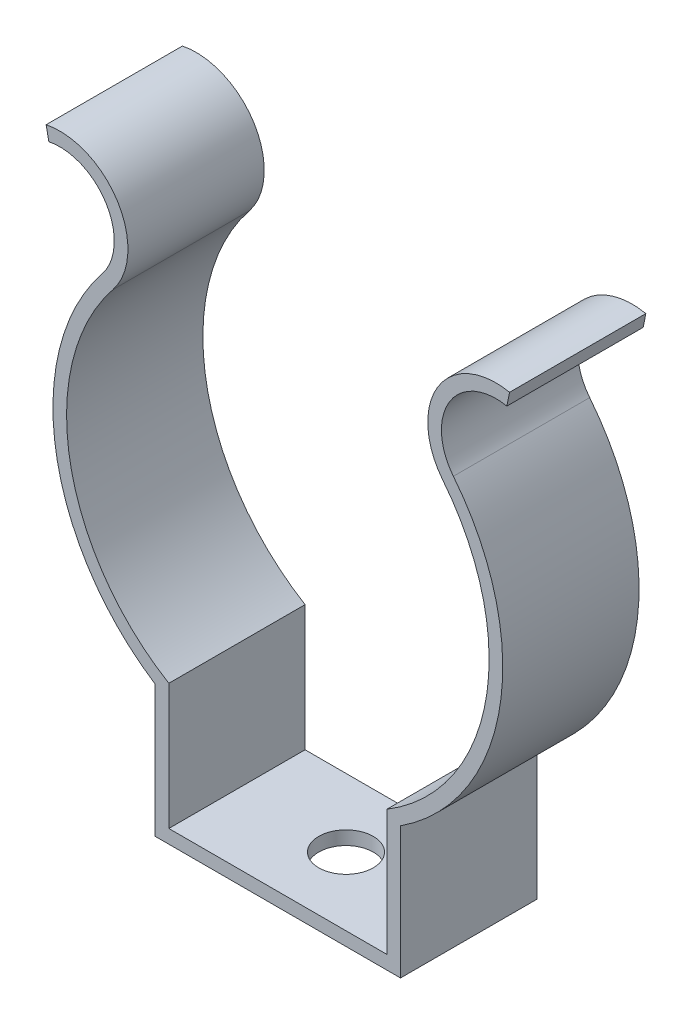
from build123d import *

# Parameters (mm, degrees)
BOSS_EXTRUDE1_DEPTH = 10
SKETCH2_R           = 2
CUT_EXTRUDE1_DEPTH  = 10


with BuildPart() as part:
    # Sketch1 → Boss-Extrude1 (new body)
    with BuildSketch(Plane.XY):
        with BuildLine():
            Line((8, -22.5), (8, -13.275918047))
            ThreePointArc((8, -13.275918047), (15.259032291, -2.722486649), (12.097560976, 9.690150589))
            ThreePointArc((12.097560976, 9.690150589), (11.733206084, 15.422625974), (17, 17.714985104))
            Line((17, 17.714985104), (16.8, 16.735189206))
            ThreePointArc((16.8, 16.735189206), (12.586564868, 14.901301903), (12.87804878, 10.315321595))
            ThreePointArc((12.87804878, 10.315321595), (16.291198361, -2.616649759), (9, -13.829316686))
            Line((9, -13.829316686), (9, -23.5))
            Line((9, -23.5), (-9, -23.5))
            Line((-9, -23.5), (-9, -13.829316686))
            ThreePointArc((-9, -13.829316686), (-16.291198361, -2.616649759), (-12.87804878, 10.315321595))
            ThreePointArc((-12.87804878, 10.315321595), (-12.586564868, 14.901301903), (-16.8, 16.735189206))
            Line((-16.8, 16.735189206), (-17, 17.714985104))
            ThreePointArc((-17, 17.714985104), (-11.733206084, 15.422625974), (-12.097560976, 9.690150589))
            ThreePointArc((-12.097560976, 9.690150589), (-15.259032291, -2.722486649), (-8, -13.275918047))
            Line((-8, -13.275918047), (-8, -22.5))
            Line((-8, -22.5), (8, -22.5))
        make_face()
    extrude(amount=BOSS_EXTRUDE1_DEPTH)

    # Sketch2 → Cut-Extrude1 (cut)
    with BuildSketch(Plane(origin=(0, -22.5, 0), x_dir=(1, 0, 0), z_dir=(0, 1, 0))):
        with Locations(Location((0, -5, 0), (0, 0, 270))):
            Circle(SKETCH2_R)
    extrude(amount=-CUT_EXTRUDE1_DEPTH, mode=Mode.SUBTRACT)


solid = part.part
